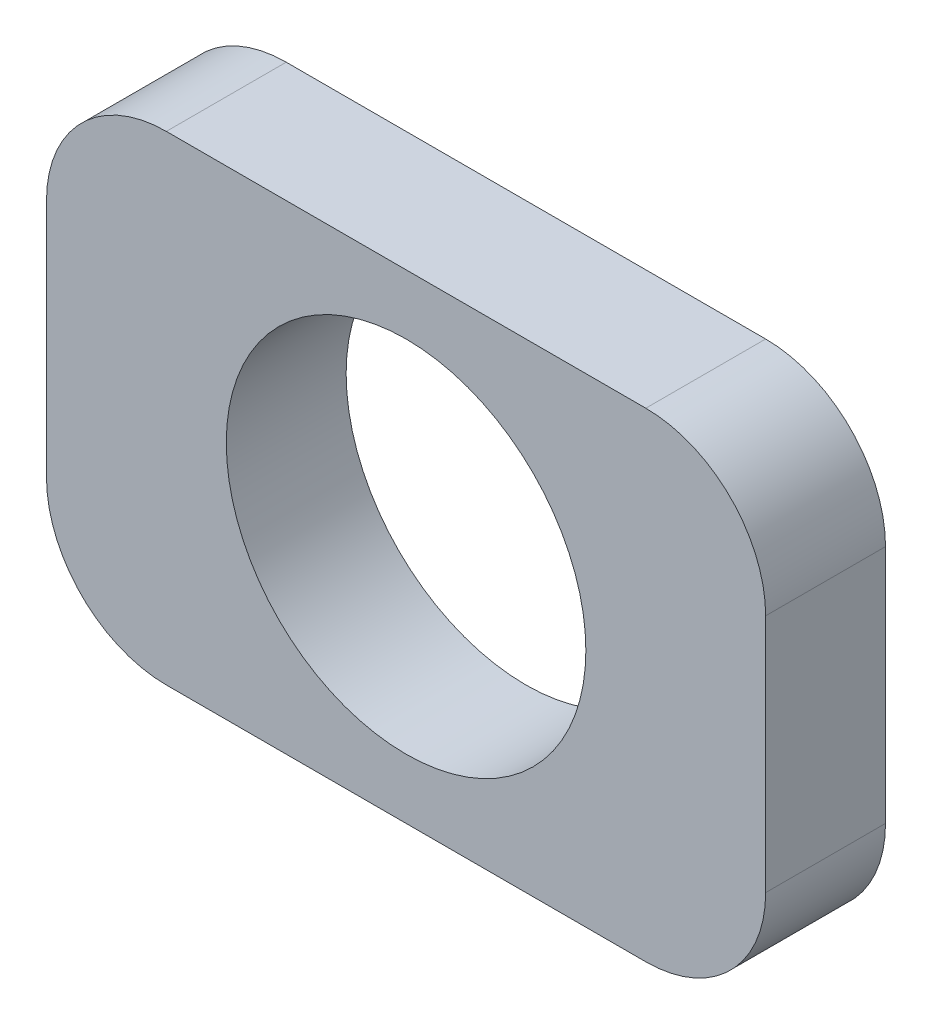
from build123d import *

# Parameters (mm, degrees)
SKETCH_1_R      = 15
EXTRUDE_1_DEPTH = 10


with BuildPart() as part:
    # Эскиз1 → Бобышка-Вытянуть1 (new body)
    with BuildSketch(Plane.XY):
        with BuildLine():
            Line((10, 0), (50, 0))
            ThreePointArc((50, 0), (57.071067812, 2.928932188), (60, 10))
            Line((60, 10), (60, 30))
            ThreePointArc((60, 30), (57.071067812, 37.071067812), (50, 40))
            Line((50, 40), (10, 40))
            ThreePointArc((10, 40), (2.928932188, 37.071067812), (0, 30))
            Line((0, 30), (0, 10))
            ThreePointArc((0, 10), (2.928932188, 2.928932188), (10, 0))
        make_face()
        with Locations((30, 20)):
            Circle(SKETCH_1_R, mode=Mode.SUBTRACT)
    extrude(amount=EXTRUDE_1_DEPTH)


solid = part.part
